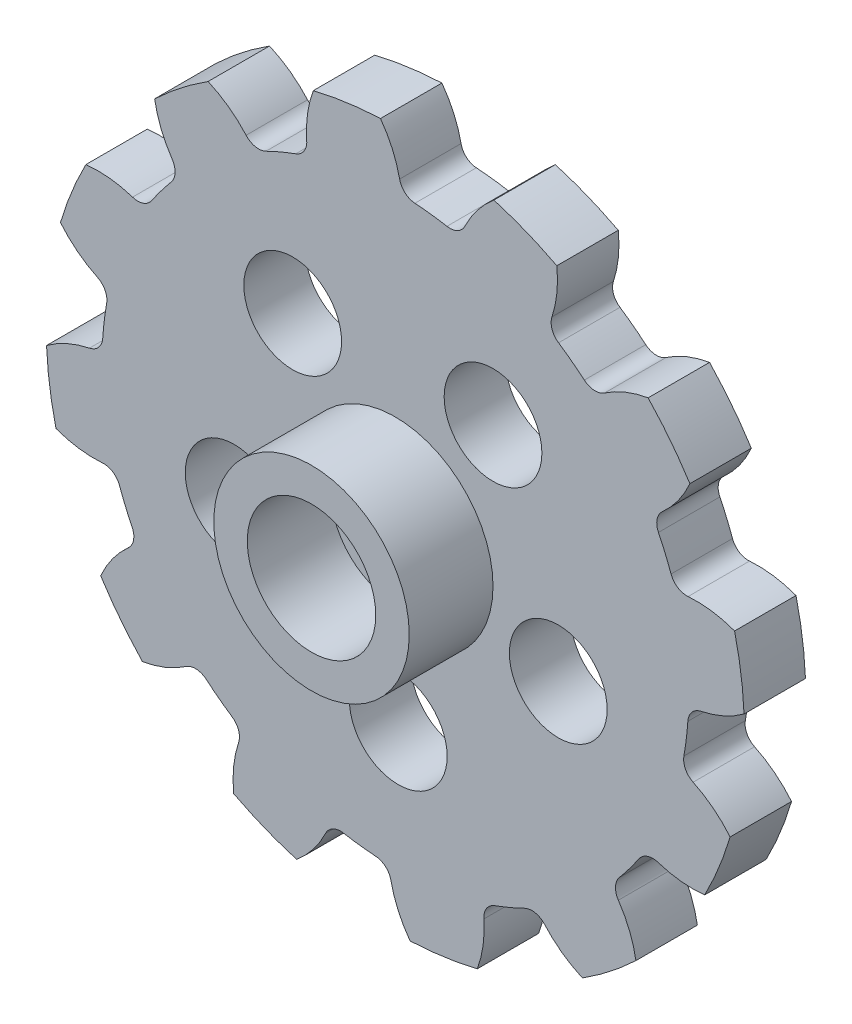
from build123d import *

# Parameters (mm, degrees)
CROQUIS1_R              = 1.1
SALIENTE_EXTRUIR1_DEPTH = 2.2
CROQUIS2_R              = 3.5
CROQUIS2_R_2            = 2.3
SALIENTE_EXTRUIR2_DEPTH = 3
CROQUIS3_R              = 2.25
CORTAR_EXTRUIR1_DEPTH   = 1
CORTAR_EXTRUIR2_DEPTH   = 10
REDONDEO2_R             = 0.6
MATRIZC3_COUNT          = 12
REDONDEO2_OF_MATRIZC3_R = 0.6
CROQUIS5_R              = 1.75
CORTAR_EXTRUIR3_DEPTH   = 10


with BuildPart() as part:
    # Croquis1 → Saliente-Extruir1 (new body)
    with BuildSketch(Plane.XY):
        with BuildLine():
            ThreePointArc((-0.530152946, 12.488752454), (-2.165678495, -12.310964083), (4.760341691, 11.558077132))
            ThreePointArc((4.760341691, 11.558077132), (2.165678495, 12.310964083), (-0.530152946, 12.488752454))
        make_face()
        Circle(CROQUIS1_R, mode=Mode.SUBTRACT)
    extrude(amount=SALIENTE_EXTRUIR1_DEPTH)

    # Croquis2 → Saliente-Extruir2 (add)
    with BuildSketch(Plane.XY.offset(2.2)):
        Circle(CROQUIS2_R)
        Circle(CROQUIS2_R_2, mode=Mode.SUBTRACT)
    extrude(amount=SALIENTE_EXTRUIR2_DEPTH)

    # Croquis3 → Cortar-Extruir1 (cut)
    with BuildSketch(Plane(origin=(0, 0, 0), x_dir=(-1, 0, 0), z_dir=(0, 0, -1))):
        Circle(CROQUIS3_R)
    extrude(amount=-CORTAR_EXTRUIR1_DEPTH, mode=Mode.SUBTRACT)

    # Croquis4 → Cortar-Extruir2 (cut)
    with BuildSketch(Plane(origin=(0, 0, 0), x_dir=(-1, 0, 0), z_dir=(0, 0, -1))):
        with BuildLine():
            ThreePointArc((0.530152946, 12.488752454), (-1.52173913, 12.407026639), (-3.532561876, 11.990454812))
            ThreePointArc((-3.532561876, 11.990454812), (-2.806282608, 11.198818067), (-2.32129731, 10.240194275))
            ThreePointArc((-2.32129731, 10.240194275), (-1.27826087, 10.421902377), (-0.22222799, 10.497648057))
            ThreePointArc((-0.22222799, 10.497648057), (0.016713915, 11.545062529), (0.530152946, 12.488752454))
        make_face()
    cortar_extruir2 = extrude(amount=-CORTAR_EXTRUIR2_DEPTH, mode=Mode.SUBTRACT)

    # Redondeo2
    redondeo2_edges = [part.edges().sort_by_distance(p)[0] for p in [
        (0.22222799, 10.497648057, 1.1),
        (2.32129731, 10.240194275, 1.1),
    ]]
    fillet(redondeo2_edges, radius=REDONDEO2_R)

    # MatrizC3: Cortar-Extruir2 ×12 about axis
    matrizc3_axis = Axis((0, 0, 0), (0, 0, 1))
    for i in range(1, MATRIZC3_COUNT):
        add(cortar_extruir2.rotate(matrizc3_axis, i * 360 / MATRIZC3_COUNT), mode=Mode.SUBTRACT)

    # Redondeo2 of MatrizC3
    redondeo2_of_matrizc3_edges = [part.edges().sort_by_distance(p)[0] for p in [
        (-5.056368943, 9.202343892, 1.1),
        (-3.109794697, 10.028917037, 1.1),
        (-8.980115902, 5.441279113, 1.1),
        (-7.707619727, 7.130399578, 1.1),
        (-10.497648057, 0.22222799, 1.1),
        (-10.240194275, 2.32129731, 1.1),
        (-9.202343892, -5.056368943, 1.1),
        (-10.028917037, -3.109794697, 1.1),
        (-5.441279113, -8.980115902, 1.1),
        (-7.130399578, -7.707619727, 1.1),
        (-0.22222799, -10.497648057, 1.1),
        (-2.32129731, -10.240194275, 1.1),
        (5.056368943, -9.202343892, 1.1),
        (3.109794697, -10.028917037, 1.1),
        (8.980115902, -5.441279113, 1.1),
        (7.707619727, -7.130399578, 1.1),
        (10.497648057, -0.22222799, 1.1),
        (10.240194275, -2.32129731, 1.1),
        (9.202343892, 5.056368943, 1.1),
        (10.028917037, 3.109794697, 1.1),
        (5.441279113, 8.980115902, 1.1),
        (7.130399578, 7.707619727, 1.1),
    ]]
    fillet(redondeo2_of_matrizc3_edges, radius=REDONDEO2_OF_MATRIZC3_R)

    # Croquis5 → Cortar-Extruir3 (cut)
    with BuildSketch(Plane(origin=(0, 0, 0), x_dir=(-1, 0, 0), z_dir=(0, 0, -1))):
        with Locations((-3.5, 5)):
            Circle(CROQUIS5_R)
        with Locations((3.673723101, 4.873782779)):
            Circle(CROQUIS5_R)
        with Locations((5.770485742, -1.987836589)):
            Circle(CROQUIS5_R)
        with Locations((-0.107366781, -6.102333355)):
            Circle(CROQUIS5_R)
        with Locations((-5.836842062, -1.783612835)):
            Circle(CROQUIS5_R)
    extrude(amount=-CORTAR_EXTRUIR3_DEPTH, mode=Mode.SUBTRACT)


solid = part.part
